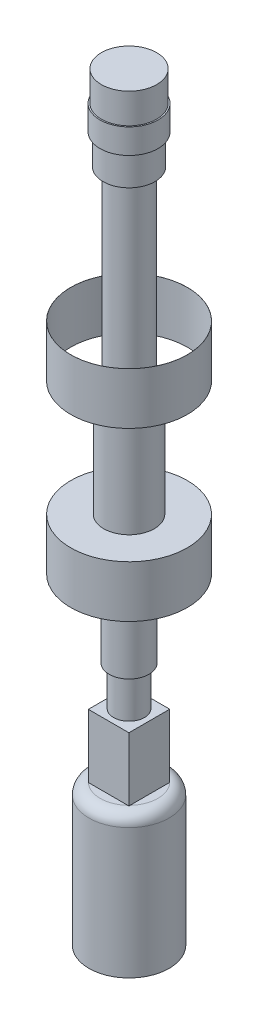
from build123d import *

# Parameters (mm, degrees)
SKETCH_6_R       = 17.732160556
EXTRUDE_4_DEPTH  = 10
SKETCH_7_R       = 35.421112471
EXTRUDE_5_DEPTH  = 95
SKETCH_8_R       = 35.421112471
EXTRUDE_6_DEPTH  = 30
FILLET_1_R       = 10
SKETCH_9_W       = 35.822826906
SKETCH_9_H       = 36.052621251
EXTRUDE_7_DEPTH  = 56
SKETCH_10_R      = 13.662426113
EXTRUDE_8_DEPTH  = 35
SKETCH_11_R      = 17.544973597
EXTRUDE_9_DEPTH  = 48
SKETCH_12_R      = 12.5
EXTRUDE_10_DEPTH = 20
SKETCH_14_R      = 20
EXTRUDE_12_DEPTH = 20
SKETCH_13_R      = 49
SKETCH_13_R_2    = 36
EXTRUDE_13_DEPTH = 20
SKETCH_15_R      = 51.5
EXTRUDE_14_DEPTH = 45.7
SKETCH_16_R      = 22.325
EXTRUDE_17_DEPTH = 102
SKETCH_17_R      = 51.55
SKETCH_17_R_2    = 51.51
EXTRUDE_19_DEPTH = 45.7
SKETCH_18_R      = 17.03
EXTRUDE_20_DEPTH = 163.76
SKETCH_19_R      = 22.89
EXTRUDE_21_DEPTH = 26.64
SKETCH_20_R      = 25.615
EXTRUDE_22_DEPTH = 21.88
SKETCH_21_R      = 24.44
EXTRUDE_23_DEPTH = 26.5


with BuildPart() as part:
    # 草图6 → 凸台-拉伸4 (new body)
    with BuildSketch(Plane(origin=(0, 0, 0), x_dir=(1, 0, 0), z_dir=(0, 1, 0))):
        with Locations(Location((36.915881384, 31.081219188, 0), (0, 0, 270))):
            Circle(SKETCH_6_R)
    extrude(amount=EXTRUDE_4_DEPTH)

    # 草图7 → 凸台-拉伸5 (add)
    with BuildSketch(Plane(origin=(0, 10, 0), x_dir=(1, 0, 0), z_dir=(0, 1, 0))):
        with Locations(Location((36.915881384, 31.081219188, 0), (0, 0, 270))):
            Circle(SKETCH_7_R)
    extrude(amount=EXTRUDE_5_DEPTH)

    # 草图8 → 凸台-拉伸6 (add)
    with BuildSketch(Plane(origin=(0, 105, 0), x_dir=(1, 0, 0), z_dir=(0, 1, 0))):
        with Locations(Location((36.915881384, 31.081219188, 0), (0, 0, 270))):
            Circle(SKETCH_8_R)
    extrude(amount=EXTRUDE_6_DEPTH)

    # 圆角1
    fillet_1_edges = [part.edges().sort_by_distance(p)[0] for p in [
        (36.915881384, 135, -66.502331659),
    ]]
    fillet(fillet_1_edges, radius=FILLET_1_R)

    # 草图9 → 凸台-拉伸7 (add)
    with BuildSketch(Plane(origin=(0, 135, 0), x_dir=(1, 0, 0), z_dir=(0, 1, 0))):
        with Locations((37.400306067, 30.59988216)):
            Rectangle(SKETCH_9_W, SKETCH_9_H)
    extrude(amount=EXTRUDE_7_DEPTH)

    # 草图10 → 凸台-拉伸8 (add)
    with BuildSketch(Plane(origin=(0, 191, 0), x_dir=(1, 0, 0), z_dir=(0, 1, 0))):
        with Locations(Location((36.915881384, 31.081219188, 0), (0, 0, 90))):
            Circle(SKETCH_10_R)
    extrude(amount=EXTRUDE_8_DEPTH)

    # 草图11 → 凸台-拉伸9 (add)
    with BuildSketch(Plane(origin=(0, 226, 0), x_dir=(1, 0, 0), z_dir=(0, 1, 0))):
        with Locations(Location((36.915881384, 31.081219188, 0), (0, 0, 270))):
            Circle(SKETCH_11_R)
    extrude(amount=EXTRUDE_9_DEPTH)

    # 草图12 → 凸台-拉伸10 (add)
    with BuildSketch(Plane(origin=(0, 274, 0), x_dir=(1, 0, 0), z_dir=(0, 1, 0))):
        with Locations(Location((36.915881384, 31.081219188, 0), (0, 0, 270))):
            Circle(SKETCH_12_R)
    extrude(amount=EXTRUDE_10_DEPTH)

    # 草图14 → 凸台-拉伸12 (add)
    with BuildSketch(Plane(origin=(0, 274, 0), x_dir=(1, 0, 0), z_dir=(0, 1, 0))):
        with Locations(Location((36.915881384, 31.081219188, 0), (0, 0, 270))):
            Circle(SKETCH_14_R)
    extrude(amount=EXTRUDE_12_DEPTH)



with BuildPart() as body_2:
    # 草图13 → 凸台-拉伸13 (new body)
    with BuildSketch(Plane(origin=(0, 294, 0), x_dir=(1, 0, 0), z_dir=(0, 1, 0))):
        with Locations(Location((36.915881384, 31.081219188, 0), (0, 0, 270))):
            Circle(SKETCH_13_R)
        with Locations(Location((36.915881384, 31.081219188, 0), (0, 0, 270))):
            Circle(SKETCH_13_R_2, mode=Mode.SUBTRACT)
    extrude(amount=EXTRUDE_13_DEPTH)


with BuildPart() as part_1:
    add(part.part)

    add(body_2.part)  # 凸台-拉伸14 merges body 2
    # 草图15 → 凸台-拉伸14 (add)
    with BuildSketch(Plane(origin=(0, 294, 0), x_dir=(1, 0, 0), z_dir=(0, 1, 0))):
        with Locations(Location((36.915881384, 31.081219188, 0), (0, 0, 90))):
            Circle(SKETCH_15_R)
    extrude(amount=EXTRUDE_14_DEPTH)

    # 草图16 → 凸台-拉伸17 (add)
    with BuildSketch(Plane(origin=(0, 339.7, 0), x_dir=(1, 0, 0), z_dir=(0, 1, 0))):
        with Locations(Location((36.915881384, 31.081219188, 0), (0, 0, 270))):
            Circle(SKETCH_16_R)
    extrude(amount=EXTRUDE_17_DEPTH)

    # 草图18 → 凸台-拉伸20 (add)
    with BuildSketch(Plane(origin=(0, 441.7, 0), x_dir=(1, 0, 0), z_dir=(0, 1, 0))):
        with Locations(Location((36.915881384, 31.081219188, 0), (0, 0, 270))):
            Circle(SKETCH_18_R)
    extrude(amount=EXTRUDE_20_DEPTH)

    # 草图19 → 凸台-拉伸21 (add)
    with BuildSketch(Plane(origin=(0, 605.46, 0), x_dir=(1, 0, 0), z_dir=(0, 1, 0))):
        with Locations(Location((36.915881384, 31.081219188, 0), (0, 0, 270))):
            Circle(SKETCH_19_R)
    extrude(amount=EXTRUDE_21_DEPTH)

    # 草图20 → 凸台-拉伸22 (add)
    with BuildSketch(Plane(origin=(0, 632.1, 0), x_dir=(1, 0, 0), z_dir=(0, 1, 0))):
        with Locations(Location((36.915881384, 31.081219188, 0), (0, 0, 270))):
            Circle(SKETCH_20_R)
    extrude(amount=EXTRUDE_22_DEPTH)

    # 草图21 → 凸台-拉伸23 (add)
    with BuildSketch(Plane(origin=(0, 653.98, 0), x_dir=(1, 0, 0), z_dir=(0, 1, 0))):
        with Locations(Location((36.915881384, 31.081219188, 0), (0, 0, 270))):
            Circle(SKETCH_21_R)
    extrude(amount=EXTRUDE_23_DEPTH)


with BuildPart() as body_2_2:
    # 草图17 → 凸台-拉伸19 (new body)
    with BuildSketch(Plane(origin=(0, 441.7, 0), x_dir=(1, 0, 0), z_dir=(0, 1, 0))):
        with Locations(Location((36.915881384, 31.081219188, 0), (0, 0, 90))):
            Circle(SKETCH_17_R)
        with Locations(Location((36.915881384, 31.081219188, 0), (0, 0, 90))):
            Circle(SKETCH_17_R_2, mode=Mode.SUBTRACT)
    extrude(amount=EXTRUDE_19_DEPTH)


solid = Compound([part_1.part, body_2_2.part])
